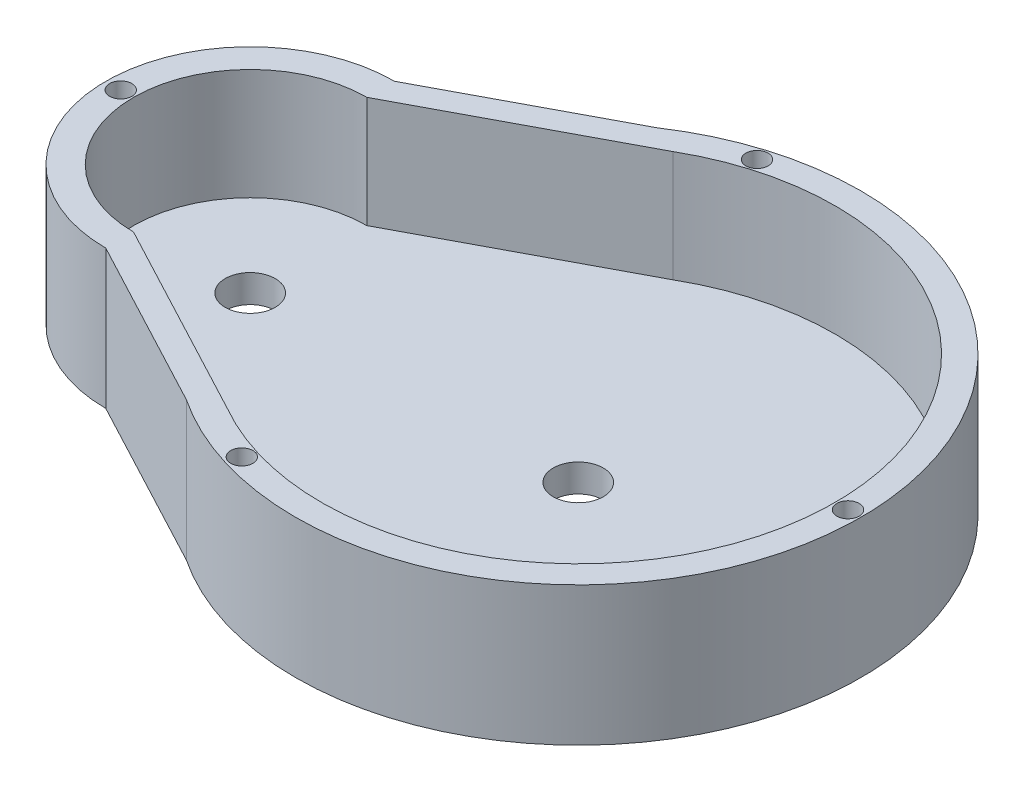
from build123d import *

# Parameters (mm, degrees)
SKETCH2_R           = 4.5
BOSS_EXTRUDE1_DEPTH = 5
BOSS_EXTRUDE4_DEPTH = 20
SKETCH4_R           = 2
CUT_EXTRUDE1_DEPTH  = 40


with BuildPart() as part:
    # Sketch2 → Boss-Extrude1 (new body)
    with BuildSketch(Plane(origin=(0, 0, 0), x_dir=(1, 0, 0), z_dir=(0, 1, 0))):
        with BuildLine():
            Line((30.852324511, 42.360372936), (0, 26))
            ThreePointArc((0, 26), (-26, 0), (0, -26))
            Line((0, -26), (30.852324511, -42.360372936))
            ThreePointArc((30.852324511, -42.360372936), (109.945, 0), (30.852324511, 42.360372936))
        make_face()
        with Locations(Location((0, 0, 0), (0, 0, 270))):
            Circle(SKETCH2_R, mode=Mode.SUBTRACT)
        with Locations(Location((59.055, 0, 0), (0, 0, 270))):
            Circle(SKETCH2_R, mode=Mode.SUBTRACT)
    extrude(amount=BOSS_EXTRUDE1_DEPTH)

    # Sketch3 → Boss-Extrude4 (add)
    with BuildSketch(Plane(origin=(0, 5, 0), x_dir=(1, 0, 0), z_dir=(0, 1, 0))):
        with BuildLine():
            Line((30.852324511, 42.360372936), (0, 26))
            ThreePointArc((0, 26), (-26, 0), (0, -26))
            Line((0, -26), (30.852324511, -42.360372936))
            ThreePointArc((30.852324511, -42.360372936), (109.945, 0), (30.852324511, 42.360372936))
        make_face()
        with BuildLine():
            Line((0, 21), (35.989825914, 40.084687562))
            ThreePointArc((35.989825914, 40.084687562), (105.301993768, 0), (35.989825914, -40.084687562))
            Line((35.989825914, -40.084687562), (0, -21))
            ThreePointArc((0, -21), (-21, 0), (0, 21))
        make_face(mode=Mode.SUBTRACT)
    extrude(amount=BOSS_EXTRUDE4_DEPTH)

    # Sketch4 → Cut-Extrude1 (cut)
    with BuildSketch(Plane(origin=(0, 25, 0), x_dir=(1, 0, 0), z_dir=(0, 1, 0))):
        with Locations(Location((-23.3, 0, 0), (0, 0, 270))):
            Circle(SKETCH4_R)
        with Locations(Location((107.605, 0, 0), (0, 0, 270))):
            Circle(SKETCH4_R)
        with Locations(Location((44.81184785, 46.422862213, 0), (0, 0, 270))):
            Circle(SKETCH4_R)
        with Locations(Location((44.81184785, -46.316966164, 0), (0, 0, 270))):
            Circle(SKETCH4_R)
    extrude(amount=-CUT_EXTRUDE1_DEPTH, mode=Mode.SUBTRACT)


solid = part.part
